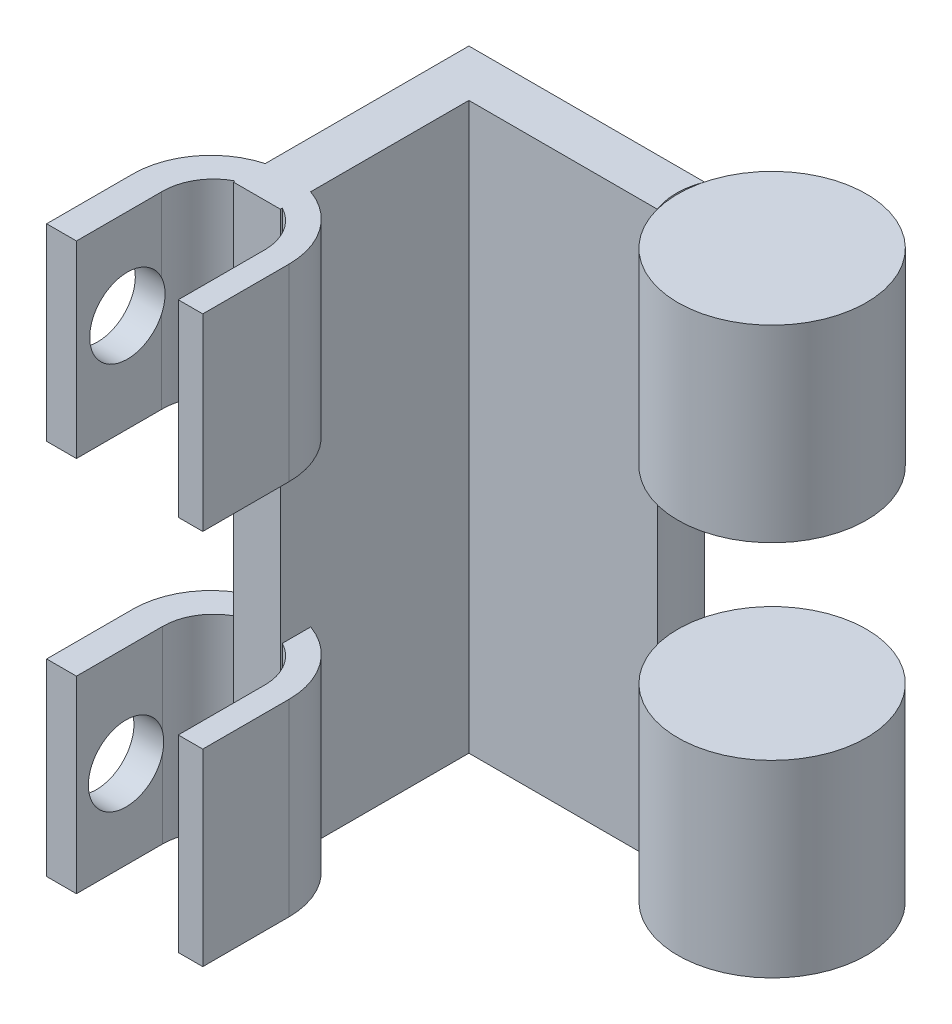
from build123d import *

# Parameters (mm, degrees)
SKETCH1_W               = 120
SKETCH1_H               = 60
BOSS_EXTRUDE4_DEPTH     = 5
CUT_EXTRUDE3_DEPTH      = 150.441021831
CUT_EXTRUDE3_DEPTH_BACK = 60
SKETCH18_R              = 10
BOSS_EXTRUDE9_DEPTH     = 20
SKETCH19_R              = 10
BOSS_EXTRUDE10_DEPTH    = 20
SKETCH20_W              = 95
SKETCH20_H              = 5
CUT_EXTRUDE4_DEPTH      = 100
SKETCH21_W              = 5
SKETCH21_H              = 60
BOSS_EXTRUDE11_DEPTH    = 20
BOSS_EXTRUDE12_DEPTH    = 20
BOSS_EXTRUDE13_START    = -20
BOSS_EXTRUDE13_DEPTH    = 20
SKETCH25_R              = 4
CUT_EXTRUDE5_DEPTH      = 5
SKETCH26_R              = 4
CUT_EXTRUDE6_DEPTH      = 5


with BuildPart() as part:
    # Sketch1 → Boss-Extrude4 (new body)
    with BuildSketch(Plane.XY):
        with Locations((-76.775798319, -59.134789916)):
            Rectangle(SKETCH1_W, SKETCH1_H)
    extrude(amount=BOSS_EXTRUDE4_DEPTH)

    # Sketch6 → Cut-Extrude3 (cut, two sides: drawn at the far end of the back side and taken through both)
    with BuildSketch(Plane(origin=(0, -29.134789916, 0), x_dir=(1, 0, 0), z_dir=(0, 1, 0)).offset(-CUT_EXTRUDE3_DEPTH_BACK)):
        with BuildLine():
            Line((72.584288463, 233.706952721), (-16.775798319, 0))
            ThreePointArc((-16.775798319, 0), (-17.237449904, -2.5), (-16.775798319, -5))
            Line((-16.775798319, -5), (72.584288463, -238.706952721))
            Line((72.584288463, -238.706952721), (573.000774441, -238.706952721))
            Line((573.000774441, -238.706952721), (573.000774441, 233.706952721))
            Line((573.000774441, 233.706952721), (72.584288463, 233.706952721))
        make_face()
    extrude(amount=CUT_EXTRUDE3_DEPTH + CUT_EXTRUDE3_DEPTH_BACK, mode=Mode.SUBTRACT)

    # Sketch20 → Cut-Extrude4 (cut)
    with BuildSketch(Plane(origin=(0, -29.134789916, 0), x_dir=(1, 0, 0), z_dir=(0, 1, 0))):
        with Locations((-89.275798319, -2.5)):
            Rectangle(SKETCH20_W, SKETCH20_H)
    extrude(amount=-CUT_EXTRUDE4_DEPTH, mode=Mode.SUBTRACT)

    # Sketch21 → Boss-Extrude11 (add)
    with BuildSketch(Plane.XY.offset(5)):
        with Locations((-39.275798319, -59.134789916)):
            Rectangle(SKETCH21_W, SKETCH21_H)
    extrude(amount=BOSS_EXTRUDE11_DEPTH)

    # Sketch22 → Boss-Extrude12 (add)
    with BuildSketch(Plane(origin=(0, -29.134789916, 0), x_dir=(1, 0, 0), z_dir=(0, 1, 0))):
        with BuildLine():
            Line((-47.845488891, -29.592327144), (-47.845488891, -38.743441952))
            Line((-47.845488891, -38.743441952), (-44.682140563, -38.743441952))
            Line((-44.682140563, -38.743441952), (-44.682140563, -29.742962779))
            ThreePointArc((-44.682140563, -29.742962779), (-39.428722802, -24.188273749), (-33.874033773, -29.44169151))
            Line((-33.874033773, -29.44169151), (-33.874033773, -38.743441952))
            Line((-33.874033773, -38.743441952), (-31.275569074, -38.743441952))
            Line((-31.275569074, -38.743441952), (-31.275569074, -29.592327144))
            ThreePointArc((-31.275569074, -29.592327144), (-39.560528983, -21.307367236), (-47.845488891, -29.592327144))
        make_face()
    extrude(amount=-BOSS_EXTRUDE12_DEPTH)

    # Sketch24 → Boss-Extrude13 (add)
    with BuildSketch(Plane(origin=(0, -89.134789916, 0), x_dir=(-1, 0, 0), z_dir=(0, -1, 0)).offset(BOSS_EXTRUDE13_START)):
        with BuildLine():
            Line((47.845488891, -29.592327144), (47.845488891, -38.743441952))
            Line((47.845488891, -38.743441952), (44.682140563, -38.743441952))
            Line((44.682140563, -38.743441952), (44.684239606, -29.592327144))
            ThreePointArc((44.684239606, -29.592327144), (39.353412297, -24.186699492), (33.874033773, -29.44169151))
            Line((33.874033773, -29.44169151), (33.874033773, -38.743441952))
            Line((33.874033773, -38.743441952), (31.275569074, -38.743441952))
            Line((31.275569074, -38.743441952), (31.275569074, -29.592327144))
            ThreePointArc((31.275569074, -29.592327144), (39.560528983, -21.307367236), (47.845488891, -29.592327144))
        make_face()
    extrude(amount=BOSS_EXTRUDE13_DEPTH)

    # Sketch25 → Cut-Extrude5 (cut)
    with BuildSketch(Plane.ZY.offset(47.845488891)):
        with Locations(Location((33.337580104, -38.703120712, 0), (0, 0, 206.018255013))):
            Circle(SKETCH25_R)
    extrude(amount=-CUT_EXTRUDE5_DEPTH, mode=Mode.SUBTRACT)

    # Sketch26 → Cut-Extrude6 (cut)
    with BuildSketch(Plane.ZY.offset(47.845488891)):
        with Locations(Location((33.479995175, -79.79002853, 0), (0, 0, 166.389284615))):
            Circle(SKETCH26_R)
    extrude(amount=-CUT_EXTRUDE6_DEPTH, mode=Mode.SUBTRACT)


with BuildPart() as body_2:
    # Sketch18 → Boss-Extrude9 (new body)
    with BuildSketch(Plane(origin=(0, -29.134789916, 0), x_dir=(1, 0, 0), z_dir=(0, 1, 0))):
        with Locations(Location((-7.093339954, -2.5, 0), (0, 0, 270))):
            Circle(SKETCH18_R)
    extrude(amount=-BOSS_EXTRUDE9_DEPTH)


with BuildPart() as body_3:
    # Sketch19 → Boss-Extrude10 (new body)
    with BuildSketch(Plane.XZ.offset(89.134789916)):
        with Locations(Location((-7.093339954, 2.5, 0), (0, 0, 270))):
            Circle(SKETCH19_R)
    extrude(amount=-BOSS_EXTRUDE10_DEPTH)


solid = Compound([part.part, body_2.part, body_3.part])
